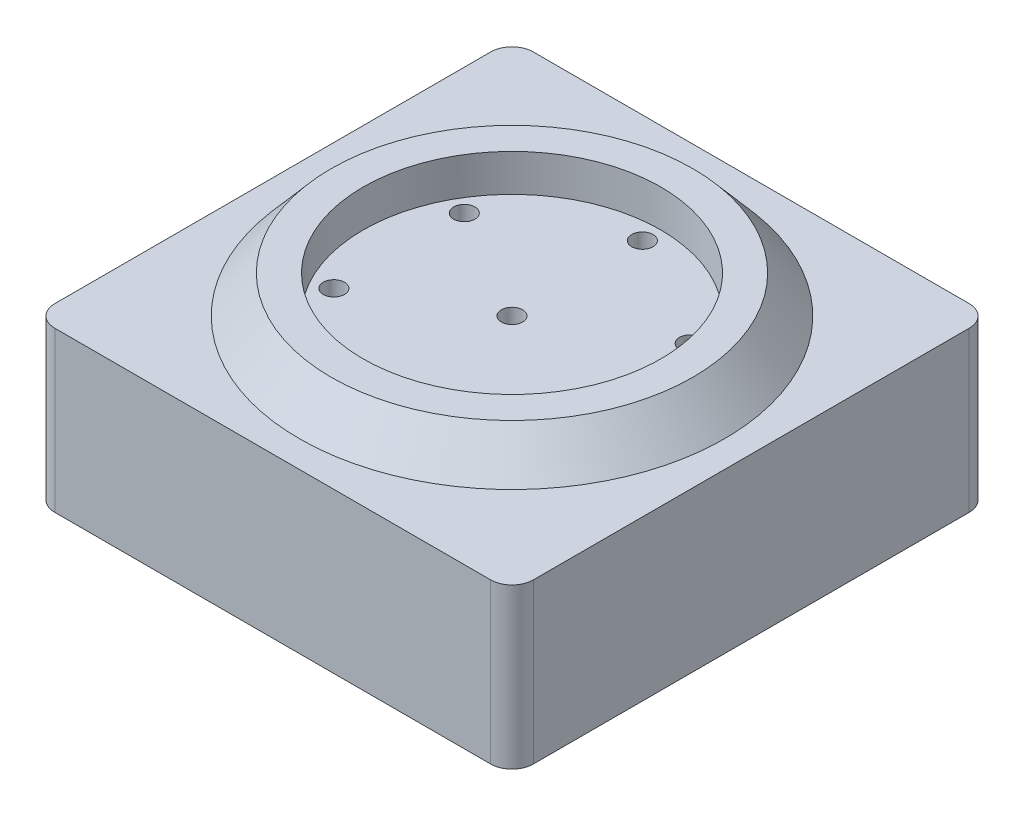
from build123d import *

# Parameters (mm, degrees)
BASE_DEPTH                      = 1500
EXTERNAL_SUPPORT_R              = 1400
TOWER_SUPPORT_DEPTH             = 3681.692869556
TOWER_START                     = -1500
BASE_MEETING_R                  = 1400
TOWER_BASE_METTING_POINT_DEPTH  = 1500
M20_MOUNTING_POINTS_R           = 100
TOWER_MOUNING_POINTS_DEPTH      = 500
GEAR_BOX_SHAFT_CONNECTION_R     = 100
GEAR_BOX_CONNECTING_POINT_DEPTH = 1000
SKETCH1_W                       = 3500
SKETCH1_H                       = 3500
BASE_PLATE_DEPTH                = 1000
SKETCH2_R                       = 10
SKETCH2_R_2                     = 100
CUT_EXTRUDE2_DEPTH              = 100


with BuildPart() as part:
    # Turbine Base → Base (new body)
    with BuildSketch(Plane(origin=(0, 0, 0), x_dir=(1, 0, 0), z_dir=(0, 1, 0))):
        with BuildLine():
            Line((-2050, 2250), (2050, 2250))
            ThreePointArc((2050, 2250), (2191.421356237, 2191.421356237), (2250, 2050))
            Line((2250, 2050), (2250, -2050))
            ThreePointArc((2250, -2050), (2191.421356237, -2191.421356237), (2050, -2250))
            Line((2050, -2250), (-2050, -2250))
            ThreePointArc((-2050, -2250), (-2191.421356237, -2191.421356237), (-2250, -2050))
            Line((-2250, -2050), (-2250, 2050))
            ThreePointArc((-2250, 2050), (-2191.421356237, 2191.421356237), (-2050, 2250))
        make_face()
    extrude(amount=BASE_DEPTH)

    # Support → Tower Support projection (revolve)
    with BuildSketch(Plane.XY, mode=Mode.PRIVATE) as tower_support_projection_sk:
        Polygon((0, 1850), (0, 1500), (2000, 1500), (1700, 1850), align=None)
    revolve(tower_support_projection_sk.sketch.rotate(Axis((0, 1850, 0), (0, -1, 0)), 180), axis=Axis((0, 1850, 0), (0, -1, 0)))

    # external support → Tower Support (cut, through all)
    with BuildSketch(Plane(origin=(0, 1850, 0), x_dir=(1, 0, 0), z_dir=(0, 1, 0))):
        with Locations(Location((0, 0, 0), (0, 0, 180))):
            Circle(EXTERNAL_SUPPORT_R)
    extrude(amount=-TOWER_SUPPORT_DEPTH, mode=Mode.SUBTRACT)

    # Base meeting → Tower Base metting point (add)
    with BuildSketch(Plane.XZ.offset(TOWER_START)):
        with Locations(Location((0, 0, 0), (0, 0, 180))):
            Circle(BASE_MEETING_R)
    extrude(amount=TOWER_BASE_METTING_POINT_DEPTH)

    # M20 mounting points → Tower Mouning points (cut)
    with BuildSketch(Plane(origin=(0, 1500, 0), x_dir=(1, 0, 0), z_dir=(0, 1, 0))):
        with Locations(Location((0, 1226.25, 0), (0, 0, 270))):
            Circle(M20_MOUNTING_POINTS_R)
        with Locations(Location((1061.963651391, 613.125, 0), (0, 0, 270))):
            Circle(M20_MOUNTING_POINTS_R)
        with Locations(Location((1061.963651391, -613.125, 0), (0, 0, 270))):
            Circle(M20_MOUNTING_POINTS_R)
        with Locations(Location((0, -1226.25, 0), (0, 0, 270))):
            Circle(M20_MOUNTING_POINTS_R)
        with Locations(Location((-1061.963651391, -613.125, 0), (0, 0, 270))):
            Circle(M20_MOUNTING_POINTS_R)
        with Locations(Location((-1061.963651391, 613.125, 0), (0, 0, 270))):
            Circle(M20_MOUNTING_POINTS_R)
    extrude(amount=-TOWER_MOUNING_POINTS_DEPTH, mode=Mode.SUBTRACT)

    # Gear box shaft connection → Gear box connecting point (cut)
    with BuildSketch(Plane(origin=(0, 1500, 0), x_dir=(1, 0, 0), z_dir=(0, 1, 0))):
        with Locations(Location((0, 0, 0), (0, 0, 270))):
            Circle(GEAR_BOX_SHAFT_CONNECTION_R)
    extrude(amount=-GEAR_BOX_CONNECTING_POINT_DEPTH, mode=Mode.SUBTRACT)

    # Sketch1 → Base plate (cut)
    with BuildSketch(Plane.XZ):
        Rectangle(SKETCH1_W, SKETCH1_H)
    extrude(amount=-BASE_PLATE_DEPTH, mode=Mode.SUBTRACT)

    # Sketch2 → Cut-Extrude2 (cut)
    with BuildSketch(Plane.XZ):
        with Locations((2230, -2230)):
            Circle(SKETCH2_R)
        with Locations((2230, 2230)):
            Circle(SKETCH2_R)
        with Locations(Location((-2050, 2050, 0), (0, 0, 270))):
            Circle(SKETCH2_R_2)
        with Locations(Location((-2050, -2050, 0), (0, 0, 90))):
            Circle(SKETCH2_R_2)
        with Locations(Location((2050, -2050, 0), (0, 0, 270))):
            Circle(SKETCH2_R_2)
        with Locations(Location((2050, 2050, 0), (0, 0, 90))):
            Circle(SKETCH2_R_2)
    extrude(amount=-CUT_EXTRUDE2_DEPTH, mode=Mode.SUBTRACT)


solid = part.part
